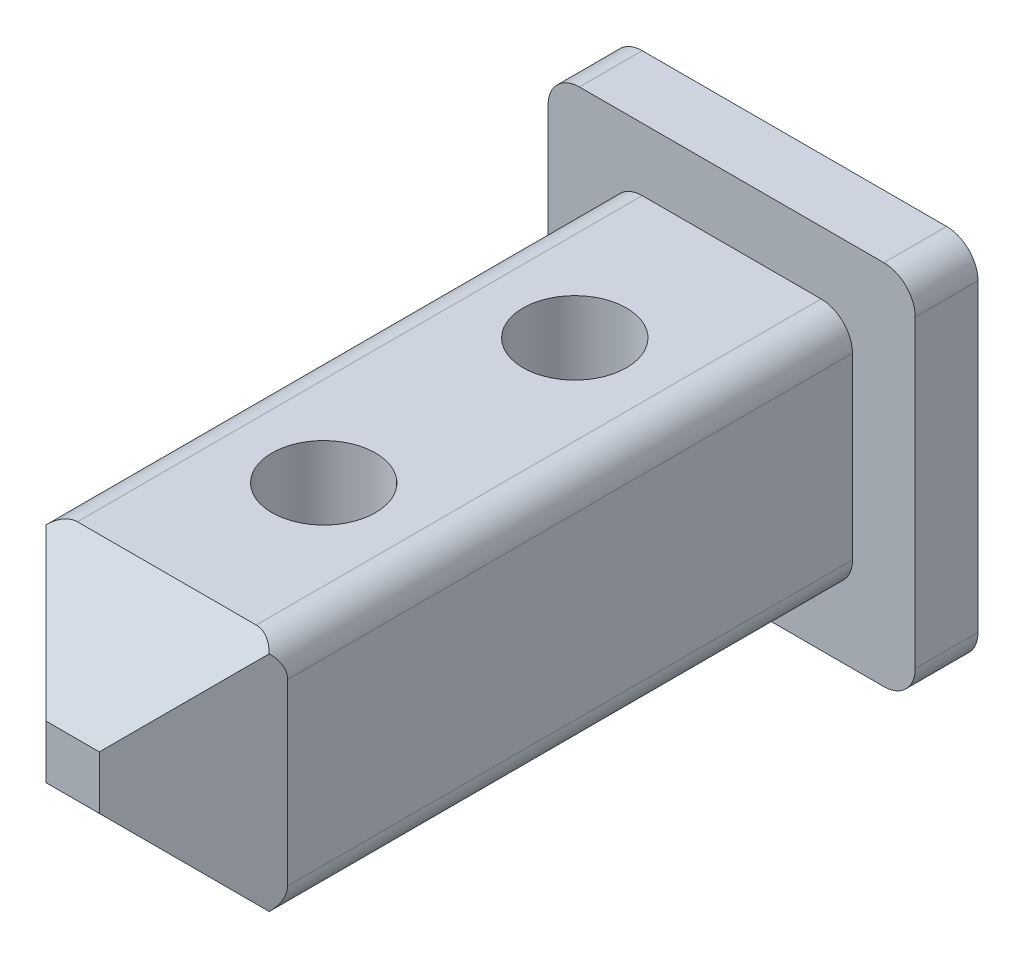
from build123d import *

# Parameters (mm, degrees)
SKETCH_1_W          = 7.7
SKETCH_1_H          = 7.7
EXTRUDE_1_DEPTH     = 21
SKETCH_2_W          = 11.7
SKETCH_2_H          = 11.7
EXTRUDE_2_DEPTH     = 2
CHAMFER_1_SIZE      = 3
FILLET_2_R          = 1
SKETCH_5_R          = 1.65
CUT_EXTRUDE_2_DEPTH = 24


with BuildPart() as part:
    # 草图1 → 凸台-拉伸1 (new body)
    with BuildSketch(Plane.XY):
        Rectangle(SKETCH_1_W, SKETCH_1_H)
    extrude(amount=EXTRUDE_1_DEPTH)

    # 草图2 → 凸台-拉伸2 (add)
    with BuildSketch(Plane(origin=(0, 0, 0), x_dir=(-1, 0, 0), z_dir=(0, 0, -1))):
        Rectangle(SKETCH_2_W, SKETCH_2_H)
    extrude(amount=EXTRUDE_2_DEPTH)

    # 倒角1
    chamfer_1_edges = [part.edges().sort_by_distance(p)[0] for p in [
        (-3.85, 0, 21),
        (0, -3.85, 21),
        (3.85, 0, 21),
        (0, 3.85, 21),
    ]]
    chamfer(chamfer_1_edges, length=CHAMFER_1_SIZE)

    # 圆角2
    fillet_2_edges = [part.edges().sort_by_distance(p)[0] for p in [
        (-5.85, -5.85, -1),
        (-5.85, 5.85, -1),
        (5.85, 5.85, -1),
        (5.85, -5.85, -1),
        (-3.85, -3.85, 9),
        (-3.85, 3.85, 9),
        (3.85, -3.85, 9),
        (3.85, 3.85, 9),
    ]]
    fillet(fillet_2_edges, radius=FILLET_2_R)

    # 草图5 → 切除-拉伸2 (cut)
    with BuildSketch(Plane.XZ.offset(3.85)):
        with Locations((0, 5)):
            Circle(SKETCH_5_R)
        with Locations((0, 13)):
            Circle(SKETCH_5_R)
    extrude(amount=-CUT_EXTRUDE_2_DEPTH, mode=Mode.SUBTRACT)


solid = part.part
